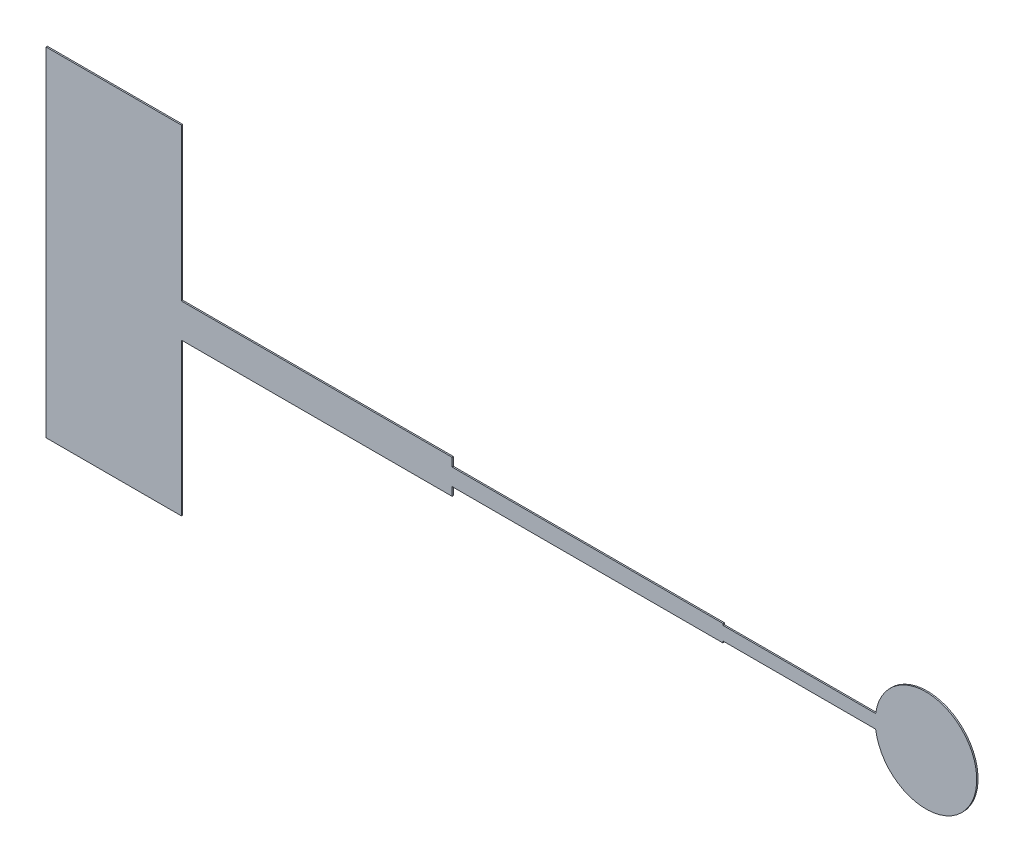
from build123d import *

# Parameters (mm, degrees)
BOSS_EXTRUDE1_DEPTH = 20


with BuildPart() as part:
    # Sketch1 → Boss-Extrude1 (new body)
    with BuildSketch(Plane.XY):
        with BuildLine():
            Line((1000, 250), (5000, 250))
            Line((5000, 250), (5000, 125))
            Line((5000, 125), (9000, 125))
            Line((9000, 125), (9000, 100))
            Line((9000, 100), (11256.696562634, 100))
            ThreePointArc((11256.696562634, 100), (12750, 0), (11256.696562634, -100))
            Line((11256.696562634, -100), (9000, -100))
            Line((9000, -100), (9000, -125))
            Line((9000, -125), (5000, -125))
            Line((5000, -125), (5000, -250))
            Line((5000, -250), (1000, -250))
            Line((1000, -250), (1000, -2500))
            Line((1000, -2500), (-1000, -2500))
            Line((-1000, -2500), (-1000, 2500))
            Line((-1000, 2500), (1000, 2500))
            Line((1000, 2500), (1000, 250))
        make_face()
    extrude(amount=-BOSS_EXTRUDE1_DEPTH)


solid = part.part
